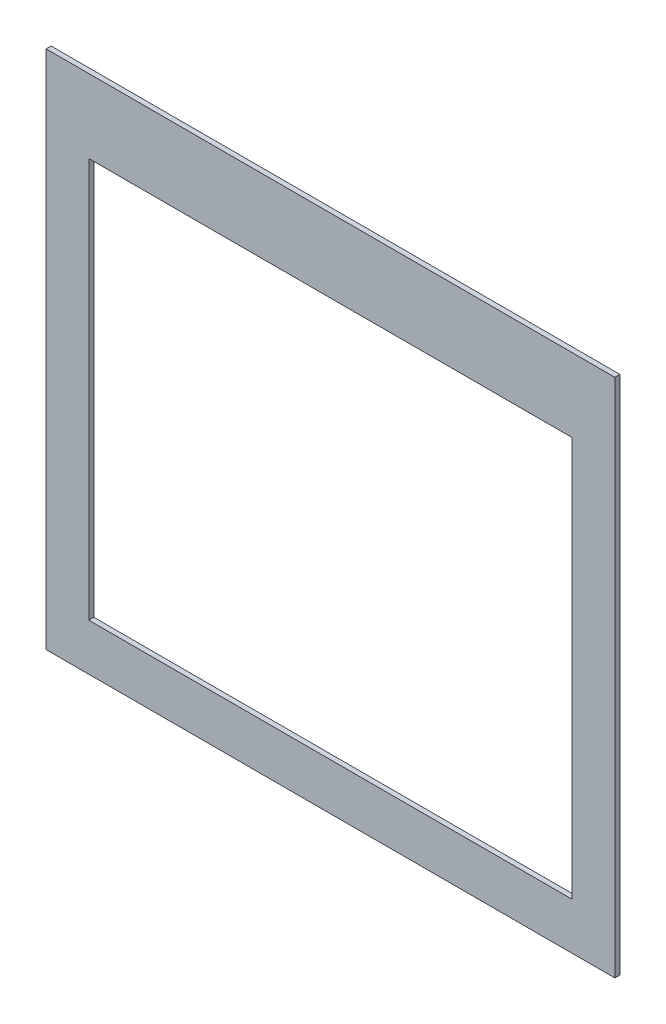
from build123d import *

# Parameters (mm, degrees)
SCHIZZO1_W                   = 340
SCHIZZO1_H                   = 311
SCHIZZO1_W_2                 = 289
SCHIZZO1_H_2                 = 239
ESTRUSIONE_ESTRUSIONE1_DEPTH = 3


with BuildPart() as part:
    # Schizzo1 → Estrusione-Estrusione1 (new body)
    with BuildSketch(Plane.XY):
        Rectangle(SCHIZZO1_W, SCHIZZO1_H)
        with Locations((0, -8)):
            Rectangle(SCHIZZO1_W_2, SCHIZZO1_H_2, mode=Mode.SUBTRACT)
    extrude(amount=ESTRUSIONE_ESTRUSIONE1_DEPTH)


solid = part.part
